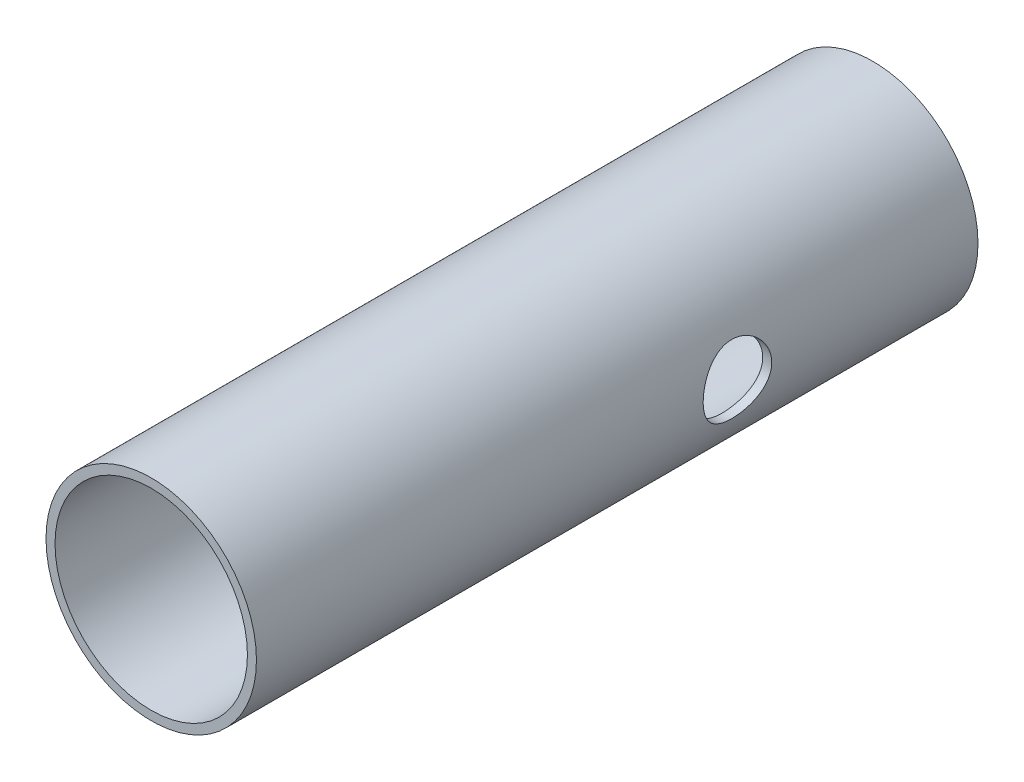
from build123d import *

# Parameters (mm, degrees)
SKETCH1_R               = 44.45
SKETCH1_R_2             = 40.64
BOSS_EXTRUDE1_DEPTH     = 304.8
CUT_EXTRUDE1_DEPTH      = 312.214789173
CUT_EXTRUDE1_DEPTH_BACK = 312.214789173
SKETCH2_R               = 14.478


with BuildPart() as part:
    # Sketch1 → Boss-Extrude1 (new body)
    with BuildSketch(Plane(origin=(0, 0, 0), x_dir=(0, 1, 0), z_dir=(0, 0, 1))):
        with Locations(Location((0, 0, 0), (0, 0, 90))):
            Circle(SKETCH1_R)
        with Locations(Location((0, 0, 0), (0, 0, 90))):
            Circle(SKETCH1_R_2, mode=Mode.SUBTRACT)
    extrude(amount=BOSS_EXTRUDE1_DEPTH)

    # Sketch2 → Cut-Extrude1 (cut, two sides: drawn at the far end of the back side and taken through both)
    with BuildSketch(Plane.YZ.offset(-CUT_EXTRUDE1_DEPTH_BACK)):
        with Locations(Location((0, 101.6, 0), (0, 0, 270))):
            Circle(SKETCH2_R)
    extrude(amount=CUT_EXTRUDE1_DEPTH + CUT_EXTRUDE1_DEPTH_BACK, mode=Mode.SUBTRACT)


solid = part.part
